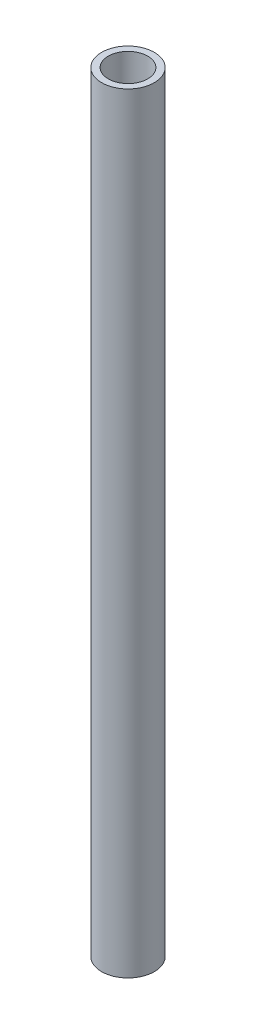
from build123d import *

# Parameters (mm, degrees)
SKETCH_1_R      = 4
SKETCH_1_R_2    = 3
EXTRUDE_1_DEPTH = 117


with BuildPart() as part:
    # 草图1 → 凸台-拉伸1 (new body)
    with BuildSketch(Plane(origin=(0, 0, 0), x_dir=(1, 0, 0), z_dir=(0, 1, 0))):
        with Locations(Location((0, 0, 0), (0, 0, 270))):
            Circle(SKETCH_1_R)
        with Locations(Location((0, 0, 0), (0, 0, 270))):
            Circle(SKETCH_1_R_2, mode=Mode.SUBTRACT)
    extrude(amount=EXTRUDE_1_DEPTH)


solid = part.part
